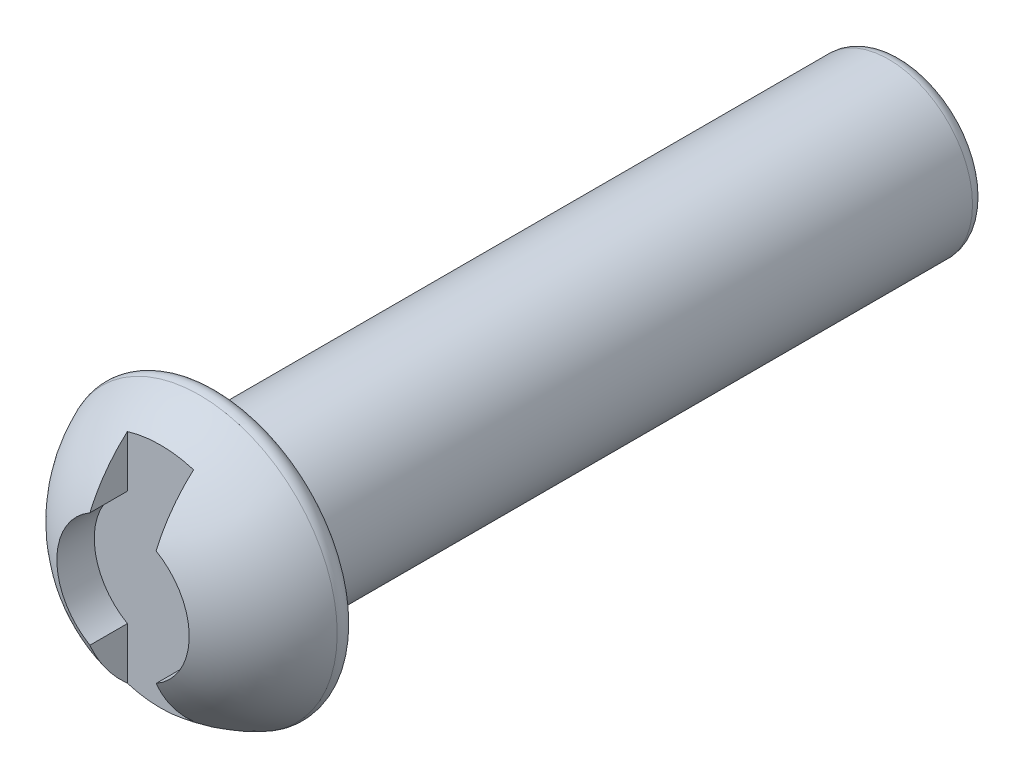
from build123d import *

# Parameters (mm, degrees)
CUT_EXTRUDE1_DEPTH = 0.6
FILLET1_R          = 0.15


with BuildPart() as part:
    # Sketch4 → Revolve2 (revolve)
    with BuildSketch(Plane(origin=(0, 0, 0), x_dir=(0, 0, -1), z_dir=(1, 0, 0))):
        with BuildLine():
            Line((0, 0), (9, 0))
            Line((9, 0), (9, 0.95))
            Line((9, 0.95), (1.25, 0.95))
            Line((1.25, 0.95), (1.25, 1.63))
            ThreePointArc((1.25, 1.63), (0.348475184, 1.027058908), (0, 0))
        make_face()
    revolve(axis=Axis((0, 0, 0), (0, 0, -1)))

    # Sketch5 → Cut-Extrude1 (cut)
    with BuildSketch(Plane.XY):
        with BuildLine():
            Line((-0.375, -0.649519053), (-0.375, -1.87097888))
            Line((-0.375, -1.87097888), (0.375, -1.87097888))
            Line((0.375, -1.87097888), (0.375, -0.649519053))
            ThreePointArc((0.375, -0.649519053), (0.75, 0), (0.375, 0.649519053))
            Line((0.375, 0.649519053), (0.375, 1.87097888))
            Line((0.375, 1.87097888), (-0.375, 1.87097888))
            Line((-0.375, 1.87097888), (-0.375, 0.649519053))
            ThreePointArc((-0.375, 0.649519053), (-0.75, 0), (-0.375, -0.649519053))
        make_face()
    extrude(amount=-CUT_EXTRUDE1_DEPTH, mode=Mode.SUBTRACT)

    # Fillet1
    fillet1_edges = [part.edges().sort_by_distance(p)[0] for p in [
        (0, -1.63, -1.25),
        (0, -0.95, -9),
    ]]
    fillet(fillet1_edges, radius=FILLET1_R)


solid = part.part
